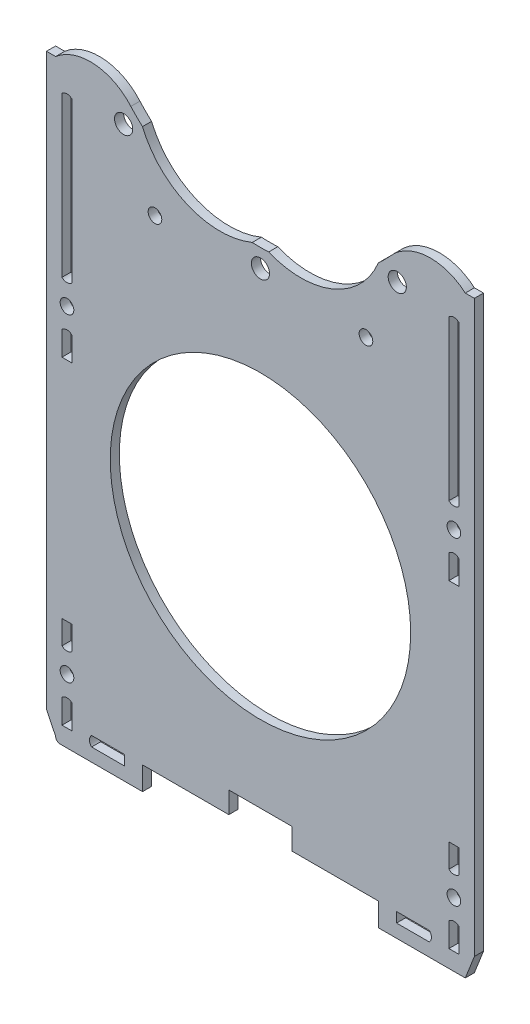
from build123d import *

# Parameters (mm, degrees)
SKETCH_3_R      = 2
SKETCH_3_R_2    = 1.999999995
SKETCH_3_R_3    = 1.5
SKETCH_3_R_4    = 33
EXTRUDE_1_DEPTH = 2


with BuildPart() as part:
    # 草图3 → 凸台-拉伸1 (new body)
    with BuildSketch(Plane.XY):
        with BuildLine():
            Line((-47, 31.317051182), (-47, -93.890216685))
            Line((-47, -93.890216685), (-45, -97.990216685))
            ThreePointArc((-45, -97.990216685), (-44.707106781, -98.697323466), (-44, -98.990216685))
            Line((-44, -98.990216685), (-25.9, -98.990216685))
            Line((-25.9, -98.990216685), (-25.9, -97.990216685))
            Line((-25.9, -97.990216685), (-25.9, -93.890216685))
            Line((-25.9, -93.890216685), (-15.9, -93.890216685))
            Line((-15.9, -93.890216685), (-6.948981504, -93.890216685))
            Line((-6.948981504, -93.890216685), (-6.948981504, -89.190216685))
            Line((-6.948981504, -89.190216685), (6.948981504, -89.190216685))
            Line((6.948981504, -89.190216685), (6.948981504, -93.890216685))
            Line((6.948981504, -93.890216685), (15.9, -93.890216685))
            Line((15.9, -93.890216685), (25.9, -93.890216685))
            Line((25.9, -93.890216685), (25.9, -97.990216685))
            Line((25.9, -97.990216685), (25.9, -98.990216685))
            Line((25.9, -98.990216685), (45, -98.990216685))
            Line((45, -98.990216685), (47, -93.890216685))
            Line((47, -93.890216685), (47, 31.317051182))
            Line((47, 31.317051182), (45, 31.317051182))
            ThreePointArc((45, 31.317051182), (36.482419799, 34.124770496), (28.474223712, 30.087289143))
            ThreePointArc((28.474223712, 30.087289143), (27.223611076, 28.776388924), (25.912710857, 27.525776288))
            ThreePointArc((25.912710857, 27.525776288), (15.928828372, 17.542283516), (1.809761925, 17.542559084))
            ThreePointArc((1.809761925, 17.542559084), (0, 17.5), (-1.809761925, 17.542559084))
            ThreePointArc((-1.809761925, 17.542559084), (-15.928828372, 17.542283516), (-25.912710857, 27.525776288))
            ThreePointArc((-25.912710857, 27.525776288), (-27.223611076, 28.776388924), (-28.474223712, 30.087289143))
            ThreePointArc((-28.474223712, 30.087289143), (-36.482419799, 34.124770496), (-45, 31.317051182))
            Line((-45, 31.317051182), (-47, 31.317051182))
        make_face()
        with Locations((0, 13.5)):
            Circle(SKETCH_3_R, mode=Mode.SUBTRACT)
        with Locations((-30.052038202, 25.947961669)):
            Circle(SKETCH_3_R_2, mode=Mode.SUBTRACT)
        with Locations((30.052038109, 25.947961893)):
            Circle(SKETCH_3_R_2, mode=Mode.SUBTRACT)
        with Locations((-23.174490752, 11.959783315)):
            Circle(SKETCH_3_R_3, mode=Mode.SUBTRACT)
        with Locations(Location((23.174490752, 11.959783315, 0), (0, 0, 180))):
            Circle(SKETCH_3_R_3, mode=Mode.SUBTRACT)
        with Locations((42.5, -14.940216685)):
            Circle(SKETCH_3_R_3, mode=Mode.SUBTRACT)
        with Locations(Location((-42.5, -14.940216685, 0), (0, 0, 180))):
            Circle(SKETCH_3_R_3, mode=Mode.SUBTRACT)
        with Locations((0, -39.340216685)):
            Circle(SKETCH_3_R_4, mode=Mode.SUBTRACT)
        with Locations((42.5, -84.940216685)):
            Circle(SKETCH_3_R_3, mode=Mode.SUBTRACT)
        with Locations((-42.5, -84.940216685)):
            Circle(SKETCH_3_R_3, mode=Mode.SUBTRACT)
        with BuildLine():
            Line((-37.1, -96.090216685), (-29.9, -96.090216685))
            Line((-29.9, -96.090216685), (-29.9, -93.890216685))
            Line((-29.9, -93.890216685), (-37.1, -93.890216685))
            ThreePointArc((-37.1, -93.890216685), (-37.555634919, -94.990216685), (-37.1, -96.090216685))
        make_face(mode=Mode.SUBTRACT)
        with BuildLine():
            Line((-43.6, -9.990216685), (-43.6, 25.009783315))
            ThreePointArc((-43.6, 25.009783315), (-42.5, 25.465418233), (-41.4, 25.009783315))
            Line((-41.4, 25.009783315), (-41.4, -9.990216685))
            ThreePointArc((-41.4, -9.990216685), (-42.5, -10.445851604), (-43.6, -9.990216685))
        make_face(mode=Mode.SUBTRACT)
        with BuildLine():
            Line((-41.4, -19.890216685), (-41.4, -25.190216685))
            Line((-41.4, -25.190216685), (-43.6, -25.190216685))
            Line((-43.6, -25.190216685), (-43.6, -19.890216685))
            ThreePointArc((-43.6, -19.890216685), (-42.5, -19.434581767), (-41.4, -19.890216685))
        make_face(mode=Mode.SUBTRACT)
        with BuildLine():
            Line((37.1, -93.890216685), (29.9, -93.890216685))
            Line((29.9, -93.890216685), (29.9, -96.090216685))
            Line((29.9, -96.090216685), (37.1, -96.090216685))
            ThreePointArc((37.1, -96.090216685), (37.555634919, -94.990216685), (37.1, -93.890216685))
        make_face(mode=Mode.SUBTRACT)
        with BuildLine():
            Line((43.6, -25.190216685), (43.6, -19.890216685))
            ThreePointArc((43.6, -19.890216685), (42.5, -19.434581767), (41.4, -19.890216685))
            Line((41.4, -19.890216685), (41.4, -25.190216685))
            Line((41.4, -25.190216685), (43.6, -25.190216685))
        make_face(mode=Mode.SUBTRACT)
        with BuildLine():
            Line((43.6, -95.190216685), (43.6, -89.890216685))
            ThreePointArc((43.6, -89.890216685), (42.5, -89.434581767), (41.4, -89.890216685))
            Line((41.4, -89.890216685), (41.4, -95.190216685))
            Line((41.4, -95.190216685), (43.6, -95.190216685))
        make_face(mode=Mode.SUBTRACT)
        with BuildLine():
            Line((41.4, -74.890216685), (41.4, -80.090216685))
            ThreePointArc((41.4, -80.090216685), (42.5, -80.545851604), (43.6, -80.090216685))
            Line((43.6, -80.090216685), (43.6, -74.890216685))
            Line((43.6, -74.890216685), (41.4, -74.890216685))
        make_face(mode=Mode.SUBTRACT)
        with BuildLine():
            Line((-41.4, -95.190216685), (-41.4, -89.890216685))
            ThreePointArc((-41.4, -89.890216685), (-42.5, -89.434581767), (-43.6, -89.890216685))
            Line((-43.6, -89.890216685), (-43.6, -95.190216685))
            Line((-43.6, -95.190216685), (-41.4, -95.190216685))
        make_face(mode=Mode.SUBTRACT)
        with BuildLine():
            Line((-43.6, -74.890216685), (-43.6, -80.090216685))
            ThreePointArc((-43.6, -80.090216685), (-42.5, -80.545851604), (-41.4, -80.090216685))
            Line((-41.4, -80.090216685), (-41.4, -74.890216685))
            Line((-41.4, -74.890216685), (-43.6, -74.890216685))
        make_face(mode=Mode.SUBTRACT)
        with BuildLine():
            Line((41.4, 25.009783315), (41.4, -9.990216685))
            ThreePointArc((41.4, -9.990216685), (42.5, -10.445851604), (43.6, -9.990216685))
            Line((43.6, -9.990216685), (43.6, 25.009783315))
            ThreePointArc((43.6, 25.009783315), (42.5, 25.465418233), (41.4, 25.009783315))
        make_face(mode=Mode.SUBTRACT)
    extrude(amount=EXTRUDE_1_DEPTH)


solid = part.part
